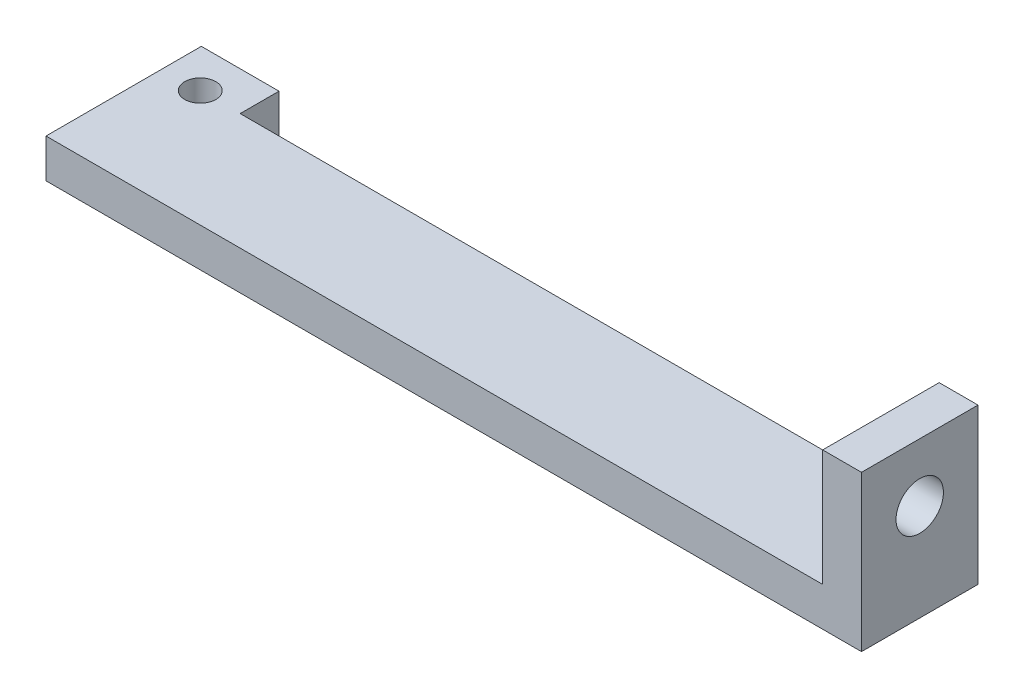
from build123d import *

# Parameters (mm, degrees)
SKETCH2_W           = 48.26
SKETCH2_H           = 7.62
BOSS_EXTRUDE1_DEPTH = 2.54
SKETCH3_W           = 5.08
SKETCH3_H           = 10.16
BOSS_EXTRUDE2_DEPTH = 2.54
SKETCH4_R           = 1.016
CUT_EXTRUDE1_DEPTH  = 2.54
SKETCH5_W           = 7.62
SKETCH5_H           = 7.62
BOSS_EXTRUDE3_DEPTH = 2.54
SKETCH7_R           = 1.55
CUT_EXTRUDE2_DEPTH  = 2.54


with BuildPart() as part:
    # Sketch2 → Boss-Extrude1 (new body)
    with BuildSketch(Plane(origin=(0, 0, 0), x_dir=(1, 0, 0), z_dir=(0, 1, 0))):
        with Locations((24.13, 3.81)):
            Rectangle(SKETCH2_W, SKETCH2_H)
    extrude(amount=BOSS_EXTRUDE1_DEPTH)

    # Sketch3 → Boss-Extrude2 (add)
    with BuildSketch(Plane(origin=(0, 0, 0), x_dir=(1, 0, 0), z_dir=(0, 1, 0))):
        with Locations((-2.54, 5.08)):
            Rectangle(SKETCH3_W, SKETCH3_H)
    extrude(amount=BOSS_EXTRUDE2_DEPTH)

    # Sketch4 → Cut-Extrude1 (cut)
    with BuildSketch(Plane(origin=(0, 2.54, 0), x_dir=(1, 0, 0), z_dir=(0, 1, 0))):
        with Locations(Location((-2.608533825, 7.62, 0), (0, 0, 270))):
            Circle(SKETCH4_R)
    extrude(amount=-CUT_EXTRUDE1_DEPTH, mode=Mode.SUBTRACT)

    # Sketch5 → Boss-Extrude3 (add)
    with BuildSketch(Plane.ZY.offset(-48.26)):
        with Locations((-3.81, 6.35)):
            Rectangle(SKETCH5_W, SKETCH5_H)
    extrude(amount=BOSS_EXTRUDE3_DEPTH)

    # Sketch7 → Cut-Extrude2 (cut)
    with BuildSketch(Plane.ZY.offset(-45.72)):
        with Locations((-3.81, 6.35)):
            Circle(SKETCH7_R)
    extrude(amount=-CUT_EXTRUDE2_DEPTH, mode=Mode.SUBTRACT)


solid = part.part
